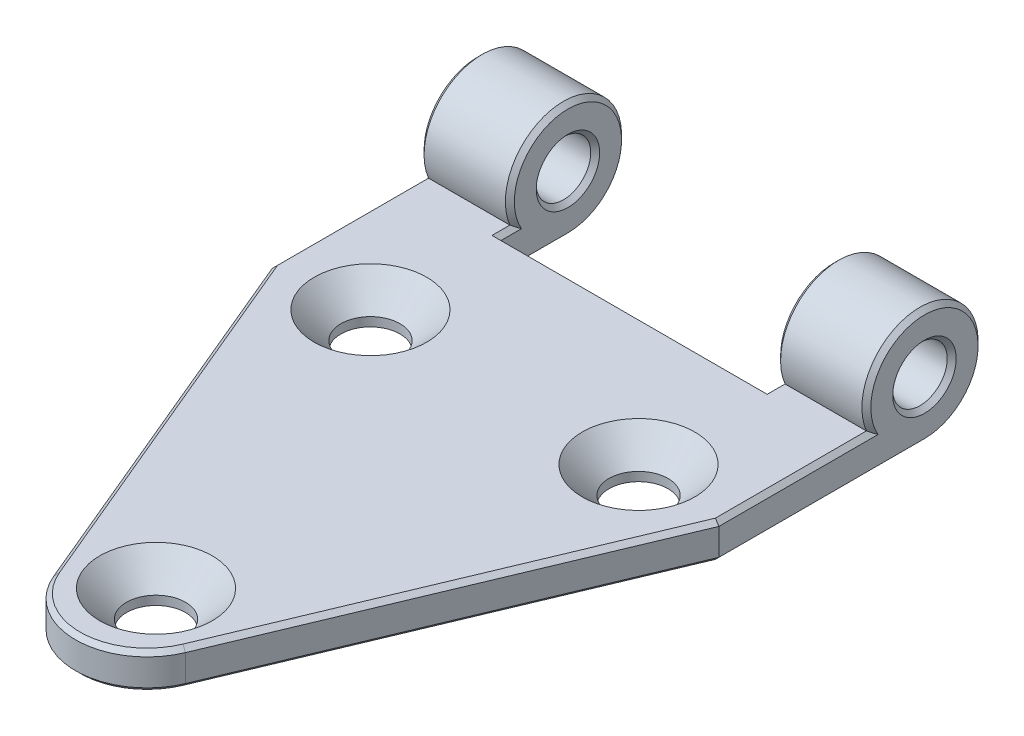
from build123d import *

# Parameters (mm, degrees)
SKETCH1_R                                       = 3.05
BOSS_EXTRUDE1_DEPTH                             = 25
SKETCH2_W                                       = 29.8
SKETCH2_H                                       = 20
CUT_EXTRUDE1_DEPTH                              = 76.45859792
CSK_FOR_M6_FLAT_HEAD_MACHINE_SCREW1_D           = 6.6
CSK_FOR_M6_FLAT_HEAD_MACHINE_SCREW1_DEPTH       = 38.017159957
CSK_FOR_M6_FLAT_HEAD_MACHINE_SCREW1_CSINK_D     = 12.6
CSK_FOR_M6_FLAT_HEAD_MACHINE_SCREW1_CSINK_ANGLE = 90
CSK_FOR_M6_FLAT_HEAD_MACHINE_SCREW1_TIP         = 1.982840043
CHAMFER1_SIZE                                   = 0.5
CHAMFER2_SIZE                                   = 0.5


with BuildPart() as part:
    # Sketch1 → Boss-Extrude1 (new, symmetric)
    with BuildSketch(Plane(origin=(0, 0, 0), x_dir=(0, 0, -1), z_dir=(1, 0, 0))):
        with BuildLine():
            Line((0, 0), (-70, 0))
            Line((-70, 0), (-70, 4))
            Line((-70, 4), (-6, 4))
            ThreePointArc((-6, 4), (3.605551275, 11.908326913), (0, 0))
        make_face()
        with Locations((0, 6.5)):
            Circle(SKETCH1_R, mode=Mode.SUBTRACT)
    extrude(amount=BOSS_EXTRUDE1_DEPTH, both=True)

    # Sketch2 → Cut-Extrude1 (cut, through all)
    with BuildSketch(Plane(origin=(0, 0, 0), x_dir=(1, 0, 0), z_dir=(0, 1, 0))):
        with Locations((0, 2.5)):
            Rectangle(SKETCH2_W, SKETCH2_H)
        with BuildLine():
            Line((-25, -23), (-7.379416922, -65.089369822))
            ThreePointArc((-7.379416922, -65.089369822), (0, -70), (7.379416922, -65.089369822))
            Line((7.379416922, -65.089369822), (25, -23))
            Line((25, -23), (25, -80))
            Line((25, -80), (-25, -80))
            Line((-25, -80), (-25, -23))
        make_face()
    extrude(amount=CUT_EXTRUDE1_DEPTH, mode=Mode.SUBTRACT)

    # CSK for M6 Flat Head Machine Screw1
    with Locations(Plane(origin=(0, 4, 0), x_dir=(1, 0, 0), z_dir=(0, 1, 0))):
        with Locations((15, -22), (-15, -22), (0, -61)):
            CounterSinkHole(CSK_FOR_M6_FLAT_HEAD_MACHINE_SCREW1_D / 2, CSK_FOR_M6_FLAT_HEAD_MACHINE_SCREW1_CSINK_D / 2, depth=CSK_FOR_M6_FLAT_HEAD_MACHINE_SCREW1_DEPTH, counter_sink_angle=CSK_FOR_M6_FLAT_HEAD_MACHINE_SCREW1_CSINK_ANGLE)
            with Locations((0, 0, -(CSK_FOR_M6_FLAT_HEAD_MACHINE_SCREW1_DEPTH + CSK_FOR_M6_FLAT_HEAD_MACHINE_SCREW1_TIP / 2))):  # 118° drill point
                Cone(0, CSK_FOR_M6_FLAT_HEAD_MACHINE_SCREW1_D / 2, CSK_FOR_M6_FLAT_HEAD_MACHINE_SCREW1_TIP, mode=Mode.SUBTRACT)

    # Chamfer1
    chamfer1_edges = [part.edges().sort_by_distance(p)[0] for p in [
        (-25, 6.5, 3.05),
        (25, 6.5, 3.05),
        (-14.9, 6.5, 3.05),
        (14.9, 6.5, 3.05),
    ]]
    chamfer(chamfer1_edges, length=CHAMFER1_SIZE)

    # Chamfer2
    chamfer2_edges = [part.edges().sort_by_distance(p)[0] for p in [
        (-25, 0, 11.5),
        (25, 0, 11.5),
        (0, 0, 70),
        (0, 0, 7.5),
        (-14.9, 0, 3.75),
        (-14.9, 11.908326913, -3.605551275),
        (14.9, 0, 3.75),
        (14.9, 11.908326913, -3.605551275),
        (-14.9, 4, 6.75),
        (0, 4, 7.5),
        (14.9, 4, 6.75),
        (16.189708461, 0, 44.044684911),
        (-16.189708461, 0, 44.044684911),
        (16.189708461, 4, 44.044684911),
        (25, 11.908326913, -3.605551275),
        (0, 4, 70),
        (-16.189708461, 4, 44.044684911),
        (-25, 4, 14.5),
        (-25, 11.908326913, -3.605551275),
        (25, 4, 14.5),
    ]]
    chamfer(chamfer2_edges, length=CHAMFER2_SIZE)


solid = part.part
